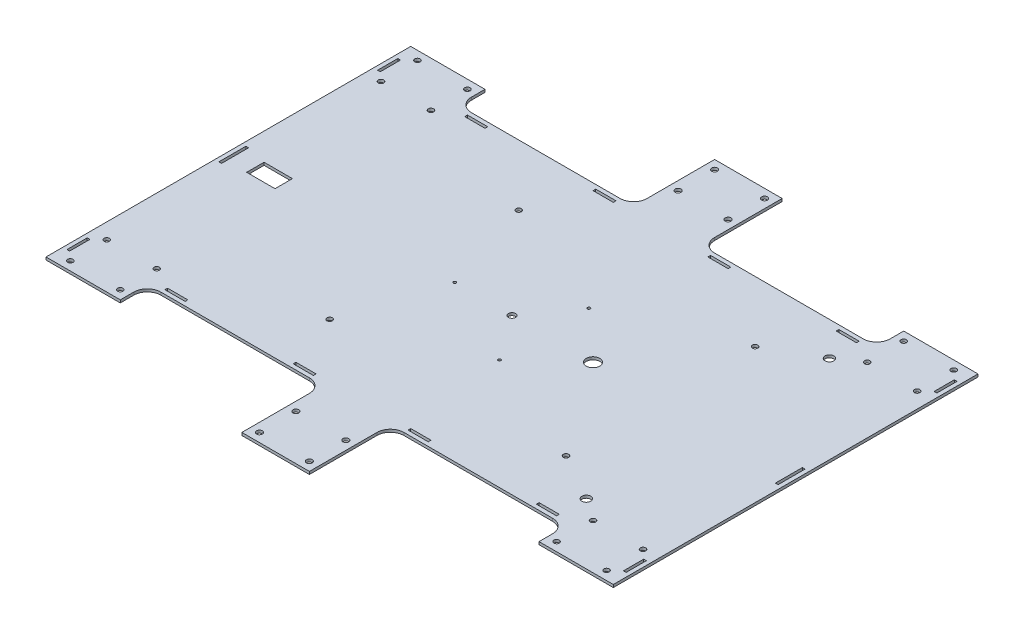
from build123d import *

# Parameters (mm, degrees)
SKETCH_1_R            = 2
SKETCH_1_R_2          = 2.15
EXTRUDE_1_DEPTH       = 2
CUT_EXTRUDE_1_DEPTH   = 274.366054952
MIRROR_2_COPY_1_DEPTH = 274.366054952
SKETCH_3_W            = 2
SKETCH_3_H            = 15
SKETCH_3_H_2          = 20
SKETCH_3_W_2          = 15
SKETCH_3_H_3          = 2
CUT_EXTRUDE_2_DEPTH   = 274.366054952
SKETCH_4_R            = 2.6
SKETCH_4_R_2          = 1
SKETCH_4_R_3          = 2
SKETCH_4_R_4          = 3.25
SKETCH_4_R_5          = 5
SKETCH_4_W            = 21
SKETCH_4_H            = 12.9
CUT_EXTRUDE_3_DEPTH   = 274.366054952


with BuildPart() as part:
    # 草图1 → 凸台-拉伸1 (new body)
    with BuildSketch(Plane(origin=(0, 0, 0), x_dir=(1, 0, 0), z_dir=(0, 1, 0))):
        Polygon((-210, -135), (-25, -135), (-25, -175), (25, -175), (25, -135), (210, -135), (210, 135), (25, 135), (25, 175), (-25, 175), (-25, 135), (-210, 135), align=None)
        with Locations(Location((198.5, 128.5, 0), (0, 0, 270))):
            Circle(SKETCH_1_R, mode=Mode.SUBTRACT)
        with Locations(Location((198.5, 101.5, 0), (0, 0, 270))):
            Circle(SKETCH_1_R, mode=Mode.SUBTRACT)
        with Locations(Location((161.5, 101.5, 0), (0, 0, 270))):
            Circle(SKETCH_1_R, mode=Mode.SUBTRACT)
        with Locations(Location((161.5, 128.5, 0), (0, 0, 270))):
            Circle(SKETCH_1_R, mode=Mode.SUBTRACT)
        with Locations(Location((198.5, -128.5, 0), (0, 0, 90))):
            Circle(SKETCH_1_R, mode=Mode.SUBTRACT)
        with Locations(Location((198.5, -101.5, 0), (0, 0, 90))):
            Circle(SKETCH_1_R, mode=Mode.SUBTRACT)
        with Locations(Location((161.5, -101.5, 0), (0, 0, 90))):
            Circle(SKETCH_1_R, mode=Mode.SUBTRACT)
        with Locations(Location((161.5, -128.5, 0), (0, 0, 90))):
            Circle(SKETCH_1_R, mode=Mode.SUBTRACT)
        with Locations(Location((-161.5, 128.5, 0), (0, 0, 90))):
            Circle(SKETCH_1_R, mode=Mode.SUBTRACT)
        with Locations(Location((-161.5, 101.5, 0), (0, 0, 90))):
            Circle(SKETCH_1_R, mode=Mode.SUBTRACT)
        with Locations(Location((-198.5, 101.5, 0), (0, 0, 90))):
            Circle(SKETCH_1_R, mode=Mode.SUBTRACT)
        with Locations(Location((-198.5, 128.5, 0), (0, 0, 90))):
            Circle(SKETCH_1_R, mode=Mode.SUBTRACT)
        with Locations(Location((-161.5, -128.5, 0), (0, 0, 270))):
            Circle(SKETCH_1_R, mode=Mode.SUBTRACT)
        with Locations(Location((-161.5, -101.5, 0), (0, 0, 270))):
            Circle(SKETCH_1_R, mode=Mode.SUBTRACT)
        with Locations(Location((-198.5, -101.5, 0), (0, 0, 270))):
            Circle(SKETCH_1_R, mode=Mode.SUBTRACT)
        with Locations(Location((-198.5, -128.5, 0), (0, 0, 270))):
            Circle(SKETCH_1_R, mode=Mode.SUBTRACT)
        with Locations(Location((18.5, 168.5, 0), (0, 0, 270))):
            Circle(SKETCH_1_R_2, mode=Mode.SUBTRACT)
        with Locations(Location((-18.5, 168.5, 0), (0, 0, 270))):
            Circle(SKETCH_1_R_2, mode=Mode.SUBTRACT)
        with Locations(Location((-18.5, 141.5, 0), (0, 0, 270))):
            Circle(SKETCH_1_R_2, mode=Mode.SUBTRACT)
        with Locations(Location((18.5, 141.5, 0), (0, 0, 270))):
            Circle(SKETCH_1_R_2, mode=Mode.SUBTRACT)
        with Locations(Location((-18.5, -141.5, 0), (0, 0, 90))):
            Circle(SKETCH_1_R_2, mode=Mode.SUBTRACT)
        with Locations(Location((18.5, -141.5, 0), (0, 0, 90))):
            Circle(SKETCH_1_R_2, mode=Mode.SUBTRACT)
        with Locations(Location((18.5, -168.5, 0), (0, 0, 90))):
            Circle(SKETCH_1_R_2, mode=Mode.SUBTRACT)
        with Locations(Location((-18.5, -168.5, 0), (0, 0, 90))):
            Circle(SKETCH_1_R_2, mode=Mode.SUBTRACT)
    extrude(amount=EXTRUDE_1_DEPTH)

    # 草图2 → 切除-拉伸1 (cut, through all)
    with BuildSketch(Plane(origin=(0, 2, 0), x_dir=(1, 0, 0), z_dir=(0, 1, 0))):
        with BuildLine():
            Line((-25, 135), (-155, 135))
            Line((-155, 135), (-155, 125))
            ThreePointArc((-155, 125), (-152.071067812, 117.928932188), (-145, 115))
            Line((-145, 115), (-35, 115))
            ThreePointArc((-35, 115), (-27.928932188, 117.928932188), (-25, 125))
            Line((-25, 125), (-25, 135))
        make_face()
    cut_extrude_1 = extrude(amount=-CUT_EXTRUDE_1_DEPTH, mode=Mode.SUBTRACT)

    # 镜向1: 切除-拉伸1 across plane
    add(cut_extrude_1.mirror(Plane.XY), mode=Mode.SUBTRACT)

    # 镜向2: 切除-拉伸1 across plane
    add(cut_extrude_1.mirror(Plane(origin=(0, 0, 0), x_dir=(0, 0, 1), z_dir=(1, 0, 0))), mode=Mode.SUBTRACT)

    # 镜向2 copy 1 sketch → 镜向2 copy 1 (cut, through all)
    with BuildSketch(Plane(origin=(0, 2, 0), x_dir=(-1, 0, 0), z_dir=(0, 1, 0))):
        with BuildLine():
            Line((-25, 135), (-155, 135))
            Line((-155, 135), (-155, 125))
            ThreePointArc((-155, 125), (-152.071067812, 117.928932188), (-145, 115))
            Line((-145, 115), (-35, 115))
            ThreePointArc((-35, 115), (-27.928932188, 117.928932188), (-25, 125))
            Line((-25, 125), (-25, 135))
        make_face()
    extrude(amount=-MIRROR_2_COPY_1_DEPTH, mode=Mode.SUBTRACT)

    # 草图3 → 切除-拉伸2 (cut, through all)
    with BuildSketch(Plane(origin=(0, 2, 0), x_dir=(1, 0, 0), z_dir=(0, 1, 0))):
        with Locations((-206, 115)):
            Rectangle(SKETCH_3_W, SKETCH_3_H)
        with Locations((-206, 0)):
            Rectangle(SKETCH_3_W, SKETCH_3_H_2)
        with Locations((-206, -115)):
            Rectangle(SKETCH_3_W, SKETCH_3_H)
        with Locations((206, -115)):
            Rectangle(SKETCH_3_W, SKETCH_3_H)
        with Locations((206, 0)):
            Rectangle(SKETCH_3_W, SKETCH_3_H_2)
        with Locations((206, 115)):
            Rectangle(SKETCH_3_W, SKETCH_3_H)
        with Locations((-137.5, 111)):
            Rectangle(SKETCH_3_W_2, SKETCH_3_H_3)
        with Locations((-42.5, 111)):
            Rectangle(SKETCH_3_W_2, SKETCH_3_H_3)
        with Locations((42.5, 111)):
            Rectangle(SKETCH_3_W_2, SKETCH_3_H_3)
        with Locations((137.5, 111)):
            Rectangle(SKETCH_3_W_2, SKETCH_3_H_3)
        with Locations((137.5, -111)):
            Rectangle(SKETCH_3_W_2, SKETCH_3_H_3)
        with Locations((42.5, -111)):
            Rectangle(SKETCH_3_W_2, SKETCH_3_H_3)
        with Locations((-42.5, -111)):
            Rectangle(SKETCH_3_W_2, SKETCH_3_H_3)
        with Locations((-137.5, -111)):
            Rectangle(SKETCH_3_W_2, SKETCH_3_H_3)
    extrude(amount=-CUT_EXTRUDE_2_DEPTH, mode=Mode.SUBTRACT)

    # 草图4 → 切除-拉伸3 (cut, through all)
    with BuildSketch(Plane.XZ):
        with Locations(Location((0, 0, 0), (0, 0, 270))):
            Circle(SKETCH_4_R)
        with Locations(Location((23.854349708, 33.1, 0), (0, 0, 270))):
            Circle(SKETCH_4_R_2)
        with Locations(Location((23.854349708, -33.1, 0), (0, 0, 270))):
            Circle(SKETCH_4_R_2)
        with Locations(Location((-42.4, 0, 0), (0, 0, 270))):
            Circle(SKETCH_4_R_2)
        with Locations(Location((-65, 70, 0), (0, 0, 270))):
            Circle(SKETCH_4_R_3)
        with Locations(Location((110, 70, 0), (0, 0, 270))):
            Circle(SKETCH_4_R_3)
        with Locations(Location((-65, -70, 0), (0, 0, 270))):
            Circle(SKETCH_4_R_3)
        with Locations(Location((110, -70, 0), (0, 0, 270))):
            Circle(SKETCH_4_R_3)
        with Locations(Location((145, -90, 0), (0, 0, 270))):
            Circle(SKETCH_4_R_4)
        with Locations(Location((145, 90, 0), (0, 0, 270))):
            Circle(SKETCH_4_R_4)
        with Locations(Location((60, 0, 0), (0, 0, 270))):
            Circle(SKETCH_4_R_5)
        with Locations((-179.5, 0)):
            Rectangle(SKETCH_4_W, SKETCH_4_H)
    extrude(amount=-CUT_EXTRUDE_3_DEPTH, mode=Mode.SUBTRACT)


solid = part.part
